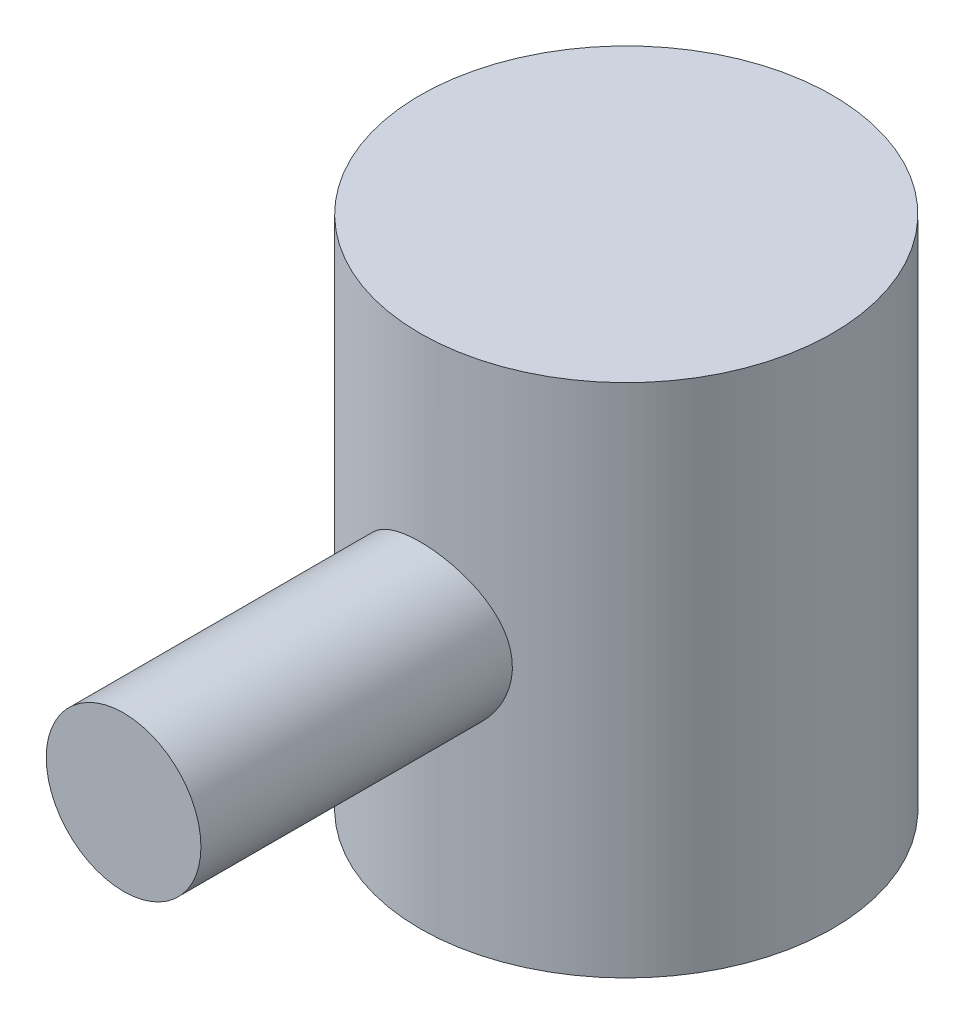
from build123d import *

# Parameters (mm, degrees)
SKETCH_1_R               = 80
EXTRUDE_1_DEPTH          = 200
SKETCH_2_R               = 30
EXTRUDE_2_DEPTH          = 195
SKETCH_3_R               = 2
CUT_EXTRUDE_1_DEPTH      = 2
PATTERN_CIRCULAR_1_COUNT = 4


with BuildPart() as part:
    # 草图1 → 凸台-拉伸1 (new body)
    with BuildSketch(Plane(origin=(0, 0, 0), x_dir=(1, 0, 0), z_dir=(0, 1, 0))):
        with Locations(Location((0, 0, 0), (0, 0, 270))):
            Circle(SKETCH_1_R)
    extrude(amount=EXTRUDE_1_DEPTH)

    # 草图2 → 凸台-拉伸2 (add)
    with BuildSketch(Plane.XY):
        with Locations(Location((0, 100, 0), (0, 0, 180))):
            Circle(SKETCH_2_R)
    extrude(amount=EXTRUDE_2_DEPTH)

    # 草图3 → 切除-拉伸1 (cut)
    with BuildSketch(Plane.XZ):
        with Locations(Location((0, 37.5, 0), (0, 0, 270))):
            Circle(SKETCH_3_R)
    cut_extrude_1 = extrude(amount=-CUT_EXTRUDE_1_DEPTH, mode=Mode.SUBTRACT)

    # 阵列(圆周)1: 切除-拉伸1 ×4 about axis
    pattern_circular_1_axis = Axis((0, 0, -0.023452158), (0, 1, 0))
    for i in range(1, PATTERN_CIRCULAR_1_COUNT):
        add(cut_extrude_1.rotate(pattern_circular_1_axis, i * 360 / PATTERN_CIRCULAR_1_COUNT), mode=Mode.SUBTRACT)


solid = part.part
